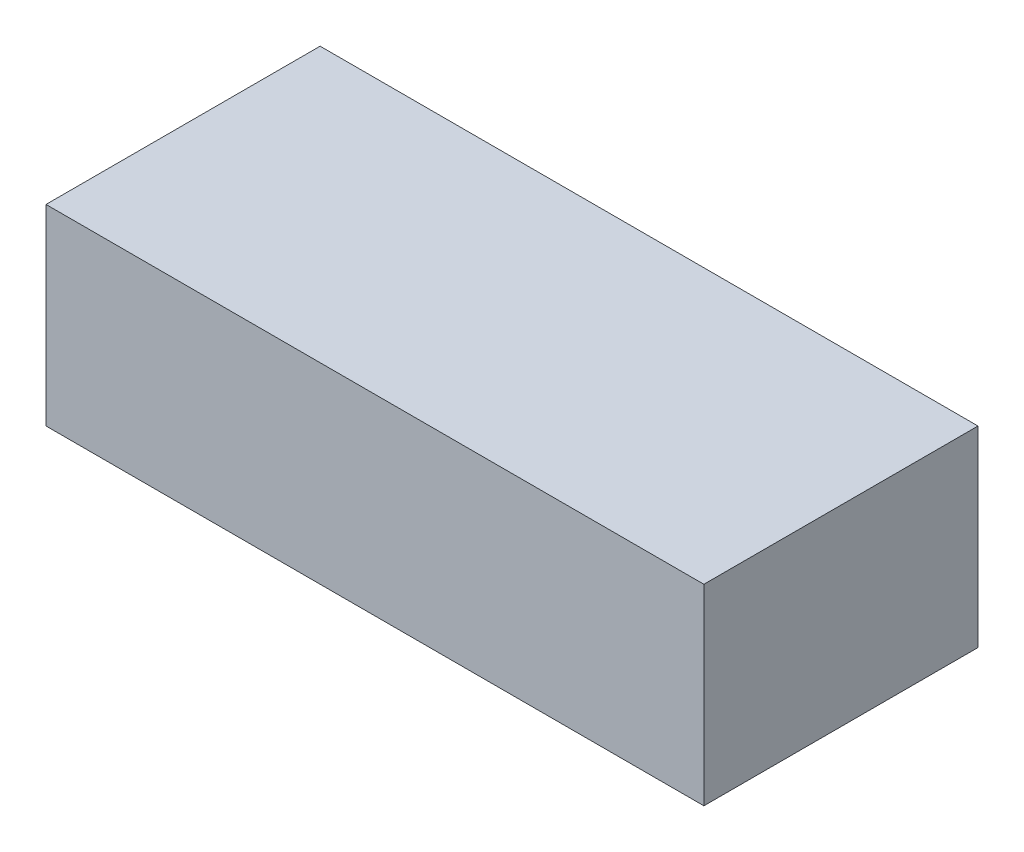
from build123d import *

# Parameters (mm, degrees)
SKETCH1_W           = 120
SKETCH1_H           = 50
BOSS_EXTRUDE1_DEPTH = 15
SKETCH2_W           = 24
SKETCH2_H           = 10
SKETCH2_W_2         = 2
SKETCH2_H_2         = 15
SKETCH2_W_3         = 1.99832088
BOSS_EXTRUDE2_DEPTH = 20
CUT_EXTRUDE1_DEPTH  = 10
SKETCH4_W           = 2
SKETCH4_H           = 30
SKETCH4_W_2         = 1.99832088
BOSS_EXTRUDE4_DEPTH = 40
SKETCH5_W           = 74
SKETCH5_H           = 15
CUT_EXTRUDE2_DEPTH  = 30
SKETCH6_R           = 3
CUT_EXTRUDE3_DEPTH  = 5
SKETCH7_W           = 2.440051729
SKETCH7_H           = 30
BOSS_EXTRUDE5_DEPTH = 40
SKETCH8_W           = 2.614904652
SKETCH8_H           = 30
BOSS_EXTRUDE6_DEPTH = 40
SKETCH9_R           = 1.5
CUT_EXTRUDE4_DEPTH  = 5


with BuildPart() as part:
    # Sketch1 → Boss-Extrude1 (new body)
    with BuildSketch(Plane(origin=(0, 0, 0), x_dir=(1, 0, 0), z_dir=(0, 1, 0))):
        with Locations((5.008183306, 25)):
            Rectangle(SKETCH1_W, SKETCH1_H)
    extrude(amount=BOSS_EXTRUDE1_DEPTH)

    # Sketch2 → Boss-Extrude2 (add)
    with BuildSketch(Plane.XZ):
        Polygon((-30.991816694, 0), (-30.991816694, -10), (-28.991816694, -10), (-6.991816694, -10), (-6.991816694, 0), align=None)
        with Locations((-42.991816694, -5)):
            Rectangle(SKETCH2_W, SKETCH2_H)
        with Locations((-29.991816694, -17.5)):
            Rectangle(SKETCH2_W_2, SKETCH2_H_2)
        with Locations((-5.992656254, -17.5)):
            Rectangle(SKETCH2_W_3, SKETCH2_H_2)
        Polygon((-6.991816694, 0), (-6.991816694, -10), (-4.993495814, -10), (17.008183306, -10), (17.008183306, 0), align=None)
        Polygon((41.008183306, 0), (17.008183306, 0), (17.008183306, -10), (19.008183306, -10), (41.008183306, -10), align=None)
        with Locations((18.008183306, -17.5)):
            Rectangle(SKETCH2_W_2, SKETCH2_H_2)
        Polygon((65.008183306, 0), (41.008183306, 0), (41.008183306, -10), (43.008183306, -10), (65.008183306, -10), align=None)
        with Locations((42.008183306, -17.5)):
            Rectangle(SKETCH2_W_2, SKETCH2_H_2)
    extrude(amount=BOSS_EXTRUDE2_DEPTH)

    # Sketch3 → Cut-Extrude1 (cut)
    with BuildSketch(Plane.XZ):
        Polygon((-54.991816694, -10), (-30.991816694, -10), (-30.991816694, -25), (-28.991816694, -25), (-28.991816694, -10), (-6.991816694, -10), (-6.991816694, -25), (-4.993495814, -25), (-4.993495814, -10), (17.008183306, -10), (17.008183306, -25), (19.008183306, -25), (19.008183306, -10), (41.008183306, -10), (41.008183306, -25), (43.008183306, -25), (43.008183306, -10), (65.008183306, -10), (65.008183306, -50), (-54.991816694, -50), align=None)
    extrude(amount=-CUT_EXTRUDE1_DEPTH, mode=Mode.SUBTRACT)

    # Sketch4 → Boss-Extrude4 (add)
    with BuildSketch(Plane(origin=(0, 0, -25), x_dir=(-1, 0, 0), z_dir=(0, 0, -1))):
        with Locations((29.991816694, -5)):
            Rectangle(SKETCH4_W, SKETCH4_H)
        with Locations((5.992656254, -5)):
            Rectangle(SKETCH4_W_2, SKETCH4_H)
        with Locations((-18.008183306, -5)):
            Rectangle(SKETCH4_W, SKETCH4_H)
        with Locations((-42.008183306, -5)):
            Rectangle(SKETCH4_W, SKETCH4_H)
    extrude(amount=BOSS_EXTRUDE4_DEPTH)

    # Sketch5 → Cut-Extrude2 (cut)
    with BuildSketch(Plane(origin=(0, 10, 0), x_dir=(1, 0, 0), z_dir=(0, 1, 0))):
        with Locations((6.008183306, 57.5)):
            Rectangle(SKETCH5_W, SKETCH5_H)
    extrude(amount=-CUT_EXTRUDE2_DEPTH, mode=Mode.SUBTRACT)

    # Sketch6 → Cut-Extrude3 (cut)
    with BuildSketch(Plane.XZ.offset(20)):
        with Locations(Location((-49.991816694, -5, 0), (0, 0, 270))):
            Circle(SKETCH6_R)
        with Locations(Location((60.008183306, -5, 0), (0, 0, 270))):
            Circle(SKETCH6_R)
    extrude(amount=-CUT_EXTRUDE3_DEPTH, mode=Mode.SUBTRACT)

    # Sketch7 → Boss-Extrude5 (add)
    with BuildSketch(Plane(origin=(0, 0, -10), x_dir=(-1, 0, 0), z_dir=(0, 0, -1))):
        with Locations((-63.788157442, -5)):
            Rectangle(SKETCH7_W, SKETCH7_H)
    extrude(amount=BOSS_EXTRUDE5_DEPTH)

    # Sketch8 → Boss-Extrude6 (add)
    with BuildSketch(Plane(origin=(0, 0, -10), x_dir=(-1, 0, 0), z_dir=(0, 0, -1))):
        with Locations((53.684364368, -5)):
            Rectangle(SKETCH8_W, SKETCH8_H)
    extrude(amount=BOSS_EXTRUDE6_DEPTH)

    # Sketch9 → Cut-Extrude4 (cut)
    with BuildSketch(Plane(origin=(0, 0, -50), x_dir=(-1, 0, 0), z_dir=(0, 0, -1))):
        with Locations((-62.508183306, 12.5)):
            Circle(SKETCH9_R)
        with Locations((52.491816694, 12.5)):
            Circle(SKETCH9_R)
    extrude(amount=-CUT_EXTRUDE4_DEPTH, mode=Mode.SUBTRACT)


solid = part.part
